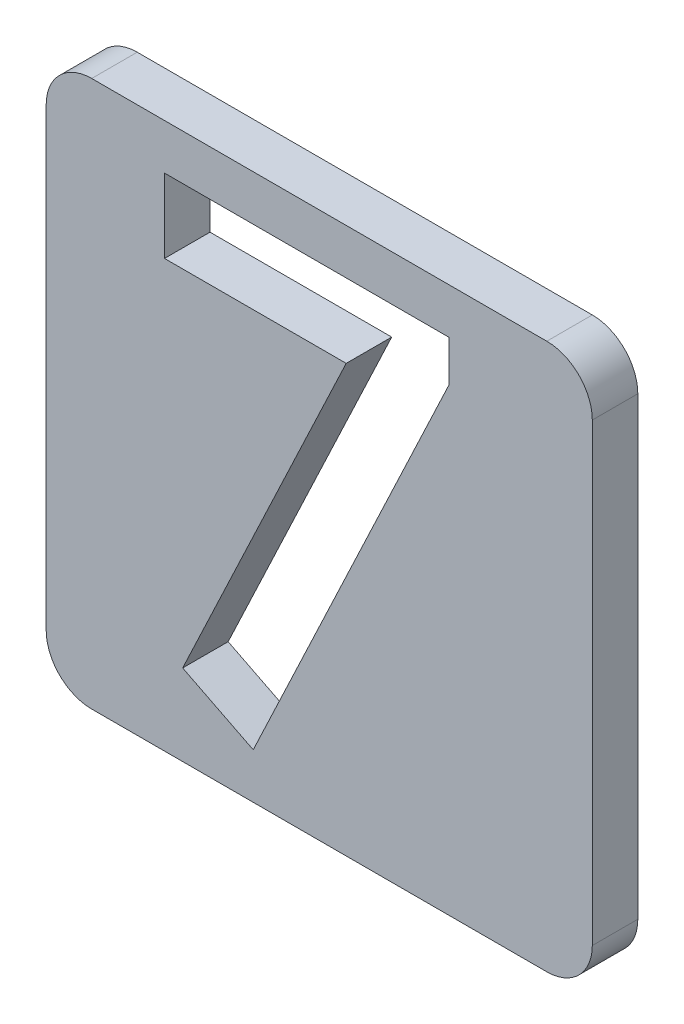
from build123d import *

# Parameters (mm, degrees)
BOSS_EXTRUDE1_DEPTH = 10
CUT_EXTRUDE6_DEPTH  = 10


with BuildPart() as part:
    # Sketch1 → Boss-Extrude1 (new body)
    with BuildSketch(Plane.XY):
        with BuildLine():
            Line((-50, 60), (50, 60))
            ThreePointArc((50, 60), (57.071067812, 57.071067812), (60, 50))
            Line((60, 50), (60, -50))
            ThreePointArc((60, -50), (57.071067812, -57.071067812), (50, -60))
            Line((50, -60), (-50, -60))
            ThreePointArc((-50, -60), (-57.071067812, -57.071067812), (-60, -50))
            Line((-60, -50), (-60, 50))
            ThreePointArc((-60, 50), (-57.071067812, 57.071067812), (-50, 60))
        make_face()
    extrude(amount=BOSS_EXTRUDE1_DEPTH)

    # Sketch2 → Cut-Extrude6 (cut)
    with BuildSketch(Plane.XY.offset(10)):
        Polygon((-34, 50), (28.5, 50), (28.5, 40.91796875), (-14.5078125, -50), (-30.015625, -42.1875), (5.921875, 33.75), (-34, 33.75), align=None)
    extrude(amount=-CUT_EXTRUDE6_DEPTH, mode=Mode.SUBTRACT)


solid = part.part
